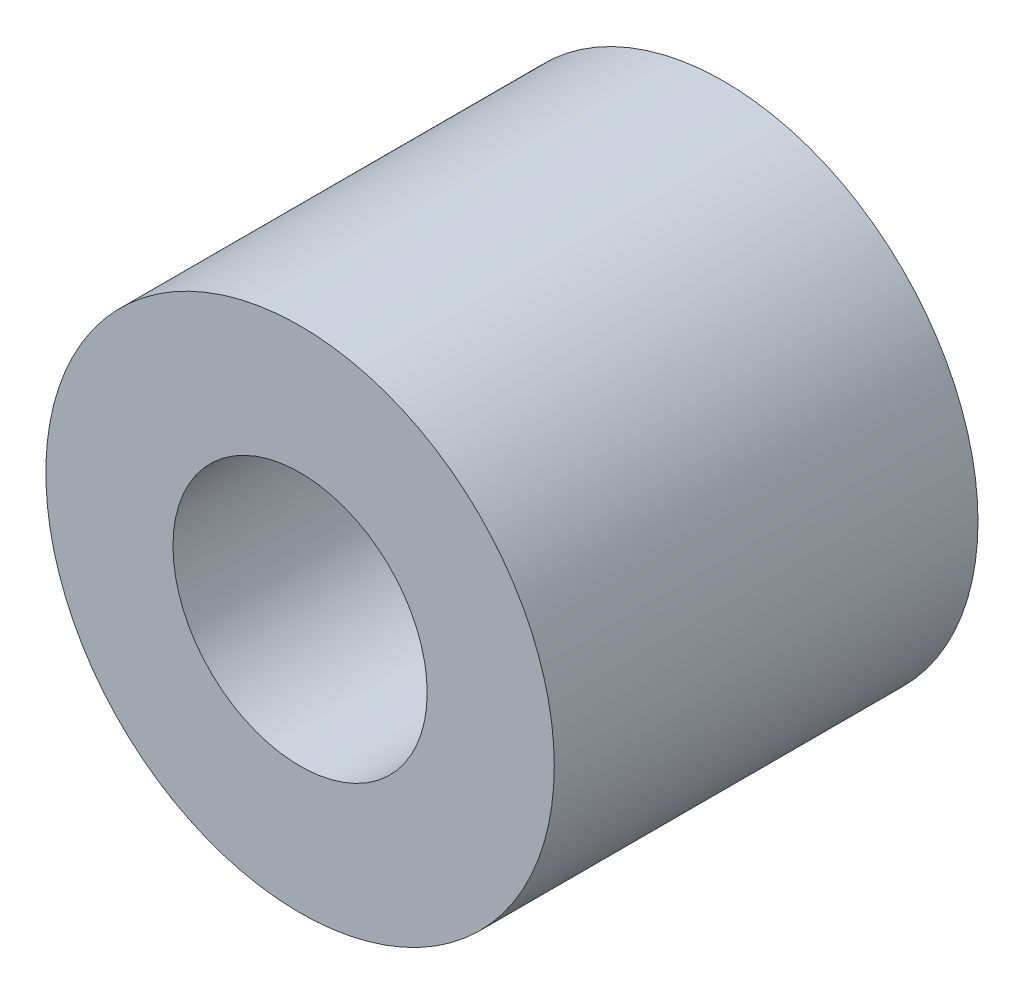
from build123d import *

# Parameters (mm, degrees)
SKETCH_1_R      = 6
SKETCH_1_R_2    = 3
EXTRUDE_1_DEPTH = 5


with BuildPart() as part:
    # 草图1 → 凸台-拉伸1 (new, symmetric)
    with BuildSketch(Plane.XY):
        Circle(SKETCH_1_R)
        Circle(SKETCH_1_R_2, mode=Mode.SUBTRACT)
    extrude(amount=EXTRUDE_1_DEPTH, both=True)


solid = part.part
